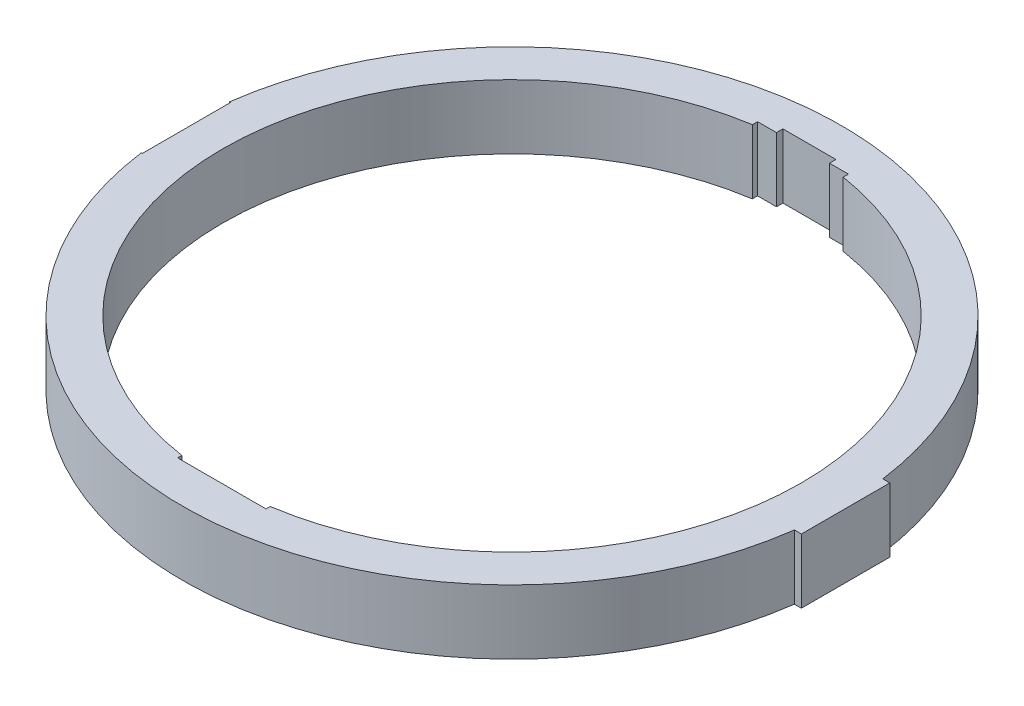
from build123d import *

# Parameters (mm, degrees)
SKETCH1_R                = 410
SKETCH1_R_2              = 360
BOSS_EXTRUDE1_DEPTH      = 80
CUT_EXTRUDE2_DEPTH       = 586.320425066
CUT_EXTRUDE2_DEPTH_BACK  = 586.320425066
SKETCH5_W                = 110
SKETCH5_H                = 80
CUT_EXTRUDE3_DEPTH       = 30
SKETCH6_R                = 31
CUT_EXTRUDE4_DEPTH       = 12
BOSS_EXTRUDE2_REACH      = 926.73
BOSS_EXTRUDE2_END_RADIUS = 410
SKETCH7_W                = 110
SKETCH7_H                = 80
SKETCH9_W                = 110
SKETCH9_H                = 80
CUT_EXTRUDE5_DEPTH       = 41.7
SKETCH10_R               = 31
CUT_EXTRUDE6_DEPTH       = 12


with BuildPart() as part:
    # Sketch1 → Boss-Extrude1 (new body)
    with BuildSketch(Plane(origin=(0, 0, 0), x_dir=(1, 0, 0), z_dir=(0, 1, 0))):
        with Locations(Location((0, 0, 0), (0, 0, 270))):
            Circle(SKETCH1_R)
        with Locations(Location((0, 0, 0), (0, 0, 270))):
            Circle(SKETCH1_R_2, mode=Mode.SUBTRACT)
    extrude(amount=BOSS_EXTRUDE1_DEPTH)

    # Sketch3 → Cut-Extrude2 (cut, two sides: drawn at the far end of the back side and taken through both)
    with BuildSketch(Plane(origin=(0, 80, 0), x_dir=(1, 0, 0), z_dir=(0, 1, 0)).offset(-CUT_EXTRUDE2_DEPTH_BACK)):
        Polygon((-56.5, 287.02643749), (56.5, 287.02643749), (56.5, 362), (33, 362), (33, 370), (-33, 370), (-33, 362), (-56.5, 362), align=None)
    extrude(amount=CUT_EXTRUDE2_DEPTH + CUT_EXTRUDE2_DEPTH_BACK, mode=Mode.SUBTRACT)

    # Sketch5 → Cut-Extrude3 (cut)
    with BuildSketch(Plane.XY.offset(361)):
        with Locations((0, 40)):
            Rectangle(SKETCH5_W, SKETCH5_H)
    extrude(amount=-CUT_EXTRUDE3_DEPTH, mode=Mode.SUBTRACT)

    # Sketch6 → Cut-Extrude4 (cut)
    with BuildSketch(Plane(origin=(0, 0, 361), x_dir=(-1, 0, 0), z_dir=(0, 0, -1))):
        with Locations((0, 40)):
            Circle(SKETCH6_R)
    extrude(amount=-CUT_EXTRUDE4_DEPTH, mode=Mode.SUBTRACT)

    # Boss-Extrude2: up to this cylinder (the profile starts outside it)
    boss_extrude2_end = Plane(origin=(0, 40, 0), z_dir=(0, -1, 0)) * Cylinder(BOSS_EXTRUDE2_END_RADIUS, 2674.46, mode=Mode.PRIVATE)
    # Sketch7 → Boss-Extrude2 (add, up to the surface)
    with BuildSketch(Plane(origin=(415, 0, 0), x_dir=(0, 0, -1), z_dir=(1, 0, 0)), mode=Mode.PRIVATE) as boss_extrude2_sk1:
        with Locations((0, 40)):
            Rectangle(SKETCH7_W, SKETCH7_H)
    boss_extrude2_tool1 = extrude(boss_extrude2_sk1.sketch, amount=-BOSS_EXTRUDE2_REACH, mode=Mode.PRIVATE) - boss_extrude2_end
    add(boss_extrude2_tool1.solids().sort_by_distance((415, 40, 0))[0])

    # Sketch9 → Cut-Extrude5 (cut)
    with BuildSketch(Plane(origin=(-405, 0, 0), x_dir=(0, 0, -1), z_dir=(1, 0, 0))):
        with Locations((0, 40)):
            Rectangle(SKETCH9_W, SKETCH9_H)
    extrude(amount=-CUT_EXTRUDE5_DEPTH, mode=Mode.SUBTRACT)

    # Sketch10 → Cut-Extrude6 (cut)
    with BuildSketch(Plane.ZY.offset(405)):
        with Locations((0, 40)):
            Circle(SKETCH10_R)
    extrude(amount=-CUT_EXTRUDE6_DEPTH, mode=Mode.SUBTRACT)


solid = part.part
